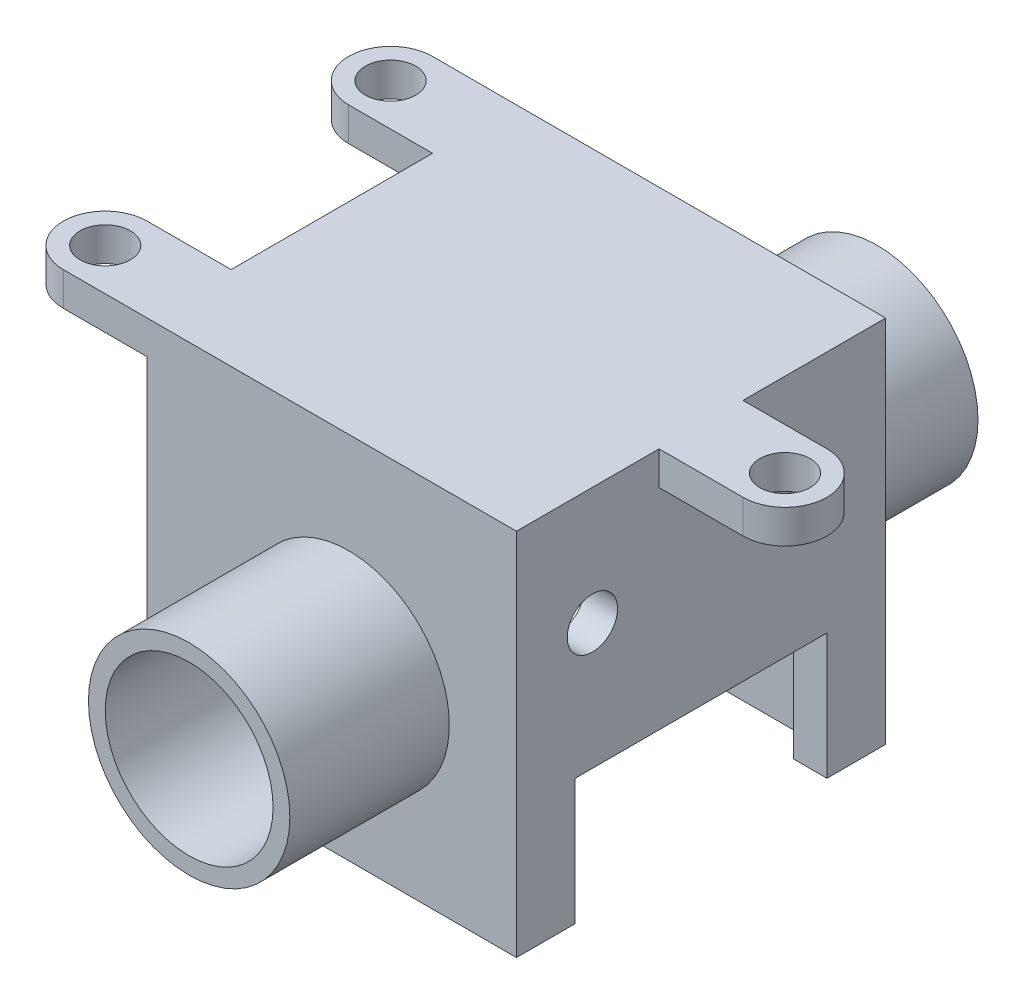
from build123d import *

# Parameters (mm, degrees)
SKETCH1_W               = 22
SKETCH1_H               = 22
BOSS_EXTRUDE1_DEPTH     = 10
SHELL1_T                = -2
SKETCH2_R               = 1.5
SKETCH2_W               = 15
SKETCH2_H               = 7.5
CUT_EXTRUDE1_DEPTH      = 8
SKETCH3_R               = 2.55
CUT_EXTRUDE2_DEPTH      = 8
CUT_EXTRUDE3_DEPTH      = 27.551836095
CUT_EXTRUDE3_DEPTH_BACK = 27.551836095
SKETCH4_R               = 5
BOSS_EXTRUDE2_START     = 10.5
SKETCH5_R               = 6
SKETCH5_R_2             = 5
BOSS_EXTRUDE2_DEPTH     = 10
SKETCH7_R               = 1.5
BOSS_EXTRUDE3_DEPTH     = 2


with BuildPart() as part:
    # Sketch1 → Boss-Extrude1 (new, symmetric)
    with BuildSketch(Plane(origin=(0, 0, 0), x_dir=(1, 0, 0), z_dir=(0, 1, 0))):
        Rectangle(SKETCH1_W, SKETCH1_H)
    extrude(amount=BOSS_EXTRUDE1_DEPTH, both=True)

    # Shell1
    shell1_openings = [part.faces().sort_by_distance(p)[0] for p in [
        (0, -10, 0),
    ]]
    offset(amount=SHELL1_T, openings=shell1_openings, kind=Kind.INTERSECTION)

    # Sketch2 → Cut-Extrude1 (cut)
    with BuildSketch(Plane(origin=(11, 0, 0), x_dir=(0, 0, -1), z_dir=(1, 0, 0))):
        with Locations((-6.475, 5)):
            Circle(SKETCH2_R)
        with Locations(Location((6.475, 5, 0), (0, 0, 180))):
            Circle(SKETCH2_R)
        with Locations((0, -6.25)):
            Rectangle(SKETCH2_W, SKETCH2_H)
    extrude(amount=-CUT_EXTRUDE1_DEPTH, mode=Mode.SUBTRACT)

    # Sketch3 → Cut-Extrude2 (cut)
    with BuildSketch(Plane.ZY.offset(11)):
        Circle(SKETCH3_R)
    extrude(amount=-CUT_EXTRUDE2_DEPTH, mode=Mode.SUBTRACT)

    # Sketch4 → Cut-Extrude3 (cut, two sides: drawn at the far end of the back side and taken through both)
    with BuildSketch(Plane(origin=(0, 0, -11), x_dir=(-1, 0, 0), z_dir=(0, 0, -1)).offset(-CUT_EXTRUDE3_DEPTH_BACK)):
        with Locations((-1, 0)):
            Circle(SKETCH4_R)
    extrude(amount=CUT_EXTRUDE3_DEPTH + CUT_EXTRUDE3_DEPTH_BACK, mode=Mode.SUBTRACT)

    # Sketch5 → Boss-Extrude2 (add)
    with BuildSketch(Plane.XY.offset(BOSS_EXTRUDE2_START)):
        with Locations(Location((1, 0, 0), (0, 0, 180))):
            Circle(SKETCH5_R)
        with Locations(Location((1, 0, 0), (0, 0, 180))):
            Circle(SKETCH5_R_2, mode=Mode.SUBTRACT)
    boss_extrude2 = extrude(amount=BOSS_EXTRUDE2_DEPTH)

    # Mirror4: Boss-Extrude2 across plane
    add(boss_extrude2.mirror(Plane.XY))

    # Sketch7 → Boss-Extrude3 (add)
    with BuildSketch(Plane(origin=(0, 10, 0), x_dir=(1, 0, 0), z_dir=(0, 1, 0))):
        with BuildLine():
            Line((-11, -6), (-16, -6))
            ThreePointArc((-16, -6), (-18.5, -8.5), (-16, -11))
            Line((-16, -11), (-11, -11))
            Line((-11, -11), (11, -11))
            Line((11, -11), (11, -2.5))
            Line((11, -2.5), (16, -2.5))
            ThreePointArc((16, -2.5), (18.5, 0), (16, 2.5))
            Line((16, 2.5), (11, 2.5))
            Line((11, 2.5), (11, 11))
            Line((11, 11), (-11, 11))
            Line((-11, 11), (-16, 11))
            ThreePointArc((-16, 11), (-18.5, 8.5), (-16, 6))
            Line((-16, 6), (-11, 6))
            Line((-11, 6), (-11, -6))
        make_face()
        with Locations(Location((-16, -8.5, 0), (0, 0, 270))):
            Circle(SKETCH7_R, mode=Mode.SUBTRACT)
        with Locations(Location((-16, 8.5, 0), (0, 0, 90))):
            Circle(SKETCH7_R, mode=Mode.SUBTRACT)
        with Locations(Location((16, 0, 0), (0, 0, 270))):
            Circle(SKETCH7_R, mode=Mode.SUBTRACT)
    extrude(amount=BOSS_EXTRUDE3_DEPTH)


solid = part.part
